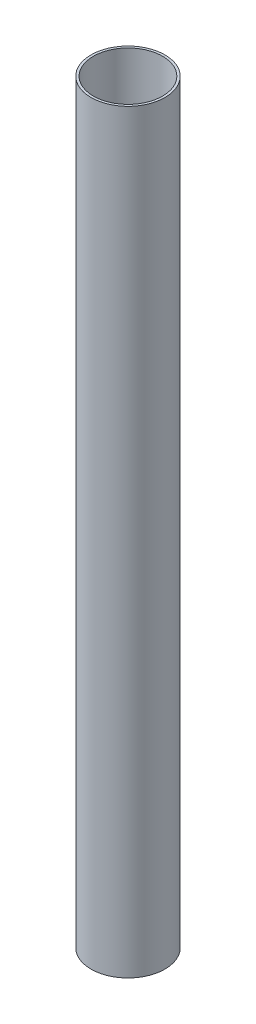
from build123d import *

# Parameters (mm, degrees)
SKETCH1_R      = 45.847
SKETCH1_R_2    = 42.926
EXTRUDE1_DEPTH = 936.625


with BuildPart() as part:
    # Sketch1 → Extrude1 (new body)
    with BuildSketch(Plane(origin=(0, 0, 0), x_dir=(1, 0, 0), z_dir=(0, 1, 0))):
        with Locations(Location((0, 0, 0), (0, 0, 270))):
            Circle(SKETCH1_R)
        with Locations(Location((0, 0, 0), (0, 0, 270))):
            Circle(SKETCH1_R_2, mode=Mode.SUBTRACT)
    extrude(amount=EXTRUDE1_DEPTH)


solid = part.part
